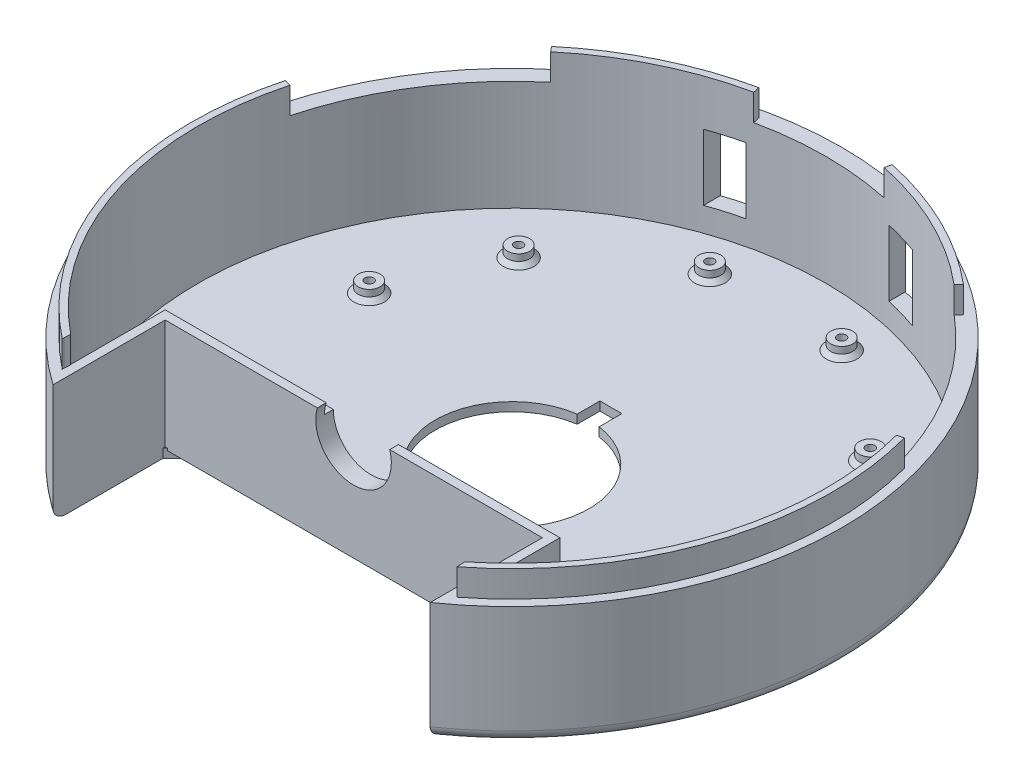
from build123d import *

# Parameters (mm, degrees)
SKETCH_1_R               = 150
EXTRUDE_1_DEPTH          = 4
SKETCH_2_R               = 150
SKETCH_2_R_2             = 145.8
EXTRUDE_2_DEPTH          = 50
SKETCH_3_R               = 145.8
SKETCH_3_R_2             = 142.8
EXTRUDE_3_DEPTH          = 62
CUT_EXTRUDE_1_DEPTH      = 223.162102979
CUT_EXTRUDE_1_DEPTH_BACK = 223.162102979
EXTRUDE_4_DEPTH          = 50
CUT_EXTRUDE_START        = -12
CUT_EXTRUDE_2_DEPTH      = 12
FILLET_1_R               = 5
CUT_EXTRUDE_3_DEPTH      = 223.162103114
CUT_EXTRUDE_3_DEPTH_BACK = 223.162103114
SKETCH_7_R               = 35
CUT_EXTRUDE_4_DEPTH      = 25
SKETCH_9_W               = 10
SKETCH_9_H               = 20
CUT_EXTRUDE_5_DEPTH      = 25
SKETCH_10_R              = 17.2
CUT_EXTRUDE_6_DEPTH      = 25
EXTRUDE_START            = 4
EXTRUDE_5_DEPTH          = 4
SKETCH_12_R              = 5
SKETCH_12_R_2            = 2
SKETCH_12_R_3            = 5.00000108
SKETCH_12_R_4            = 2.00000108
EXTRUDE_6_DEPTH          = 5
CHAMFER_1_SIZE           = 2
CHAMFER_2_SIZE           = 3
SKETCH_13_W              = 15
SKETCH_13_H              = 30
CUT_EXTRUDE_7_DEPTH      = 223.162103114


with BuildPart() as part:
    # 스케치1 → 보스-돌출1 (new body)
    with BuildSketch(Plane(origin=(0, 0, 0), x_dir=(1, 0, 0), z_dir=(0, 1, 0))):
        with Locations(Location((0, 0, 0), (0, 0, 270))):
            Circle(SKETCH_1_R)
    extrude(amount=EXTRUDE_1_DEPTH)

    # 스케치2 → 보스-돌출2 (add)
    with BuildSketch(Plane(origin=(0, 4, 0), x_dir=(1, 0, 0), z_dir=(0, 1, 0))):
        with Locations(Location((0, 0, 0), (0, 0, 270))):
            Circle(SKETCH_2_R)
        with Locations(Location((0, 0, 0), (0, 0, 270))):
            Circle(SKETCH_2_R_2, mode=Mode.SUBTRACT)
    extrude(amount=EXTRUDE_2_DEPTH)

    # 스케치3 → 보스-돌출3 (add)
    with BuildSketch(Plane(origin=(0, 4, 0), x_dir=(1, 0, 0), z_dir=(0, 1, 0))):
        with Locations(Location((0, 0, 0), (0, 0, 270))):
            Circle(SKETCH_3_R)
        with Locations(Location((0, 0, 0), (0, 0, 270))):
            Circle(SKETCH_3_R_2, mode=Mode.SUBTRACT)
    extrude(amount=EXTRUDE_3_DEPTH)

    # 스케치4 → 컷-돌출1 (cut, two sides: drawn at the far end of the back side and taken through both)
    with BuildSketch(Plane.XZ.offset(-CUT_EXTRUDE_1_DEPTH_BACK)):
        with BuildLine():
            Line((85.8, 73), (85.8, 123.038042897))
            ThreePointArc((85.8, 123.038042897), (0, 150), (-85.8, 123.038042897))
            Line((-85.8, 123.038042897), (-85.8, 73))
            Line((-85.8, 73), (-84.8, 72))
            Line((-84.8, 72), (84.8, 72))
            Line((84.8, 72), (85.8, 73))
        make_face()
    extrude(amount=CUT_EXTRUDE_1_DEPTH + CUT_EXTRUDE_1_DEPTH_BACK, mode=Mode.SUBTRACT)

    # 스케치5 → 보스-돌출4 (add)
    with BuildSketch(Plane(origin=(0, 4, 0), x_dir=(1, 0, 0), z_dir=(0, 1, 0))):
        with BuildLine():
            Line((-86.456854249, -68), (-89.8, -71.343145751))
            Line((-89.8, -71.343145751), (-89.8, -114.149901445))
            Line((-89.8, -114.149901445), (-89.8, -114.863397129))
            ThreePointArc((-89.8, -114.863397129), (-87.812965607, -116.389531622), (-85.8, -117.881296226))
            Line((-85.8, -117.881296226), (-85.8, -72))
            Line((-85.8, -72), (85.8, -72))
            Line((85.8, -72), (85.8, -117.881296226))
            ThreePointArc((85.8, -117.881296226), (87.812965607, -116.389531622), (89.8, -114.863397129))
            Line((89.8, -114.863397129), (89.8, -114.149901445))
            Line((89.8, -114.149901445), (89.8, -71.343145751))
            Line((89.8, -71.343145751), (86.45685425, -68))
            Line((86.45685425, -68), (84.8, -68))
            Line((84.8, -68), (-84.8, -68))
            Line((-84.8, -68), (-86.456854249, -68))
        make_face()
        Polygon((-89.8, -68), (-89.8, -71.343145751), (-86.456854249, -68), align=None)
        Polygon((89.8, -68), (86.45685425, -68), (89.8, -71.343145751), align=None)
    extrude(amount=EXTRUDE_4_DEPTH)

    # 스케치6 → 컷-돌출2 (cut)
    with BuildSketch(Plane(origin=(0, 66, 0), x_dir=(1, 0, 0), z_dir=(0, 1, 0)).offset(CUT_EXTRUDE_START)):
        with BuildLine():
            Line((-89.8, -114.149901445), (-89.674405594, -111.132087991))
            ThreePointArc((-89.674405594, -111.132087991), (-87.750176947, -112.657651519), (-85.8, -114.149901445))
            Line((-85.8, -114.149901445), (-85.8, -117.881296226))
            ThreePointArc((-85.8, -117.881296226), (-87.812965607, -116.389531622), (-89.8, -114.863397129))
            Line((-89.8, -114.863397129), (-89.8, -114.149901445))
        make_face()
    cut_extrude_2 = extrude(amount=CUT_EXTRUDE_2_DEPTH, mode=Mode.SUBTRACT)

    # 대칭 복사1: 컷-돌출2 across plane
    add(cut_extrude_2.mirror(Plane(origin=(0, 0, 0), x_dir=(0, 0, 1), z_dir=(1, 0, 0))), mode=Mode.SUBTRACT)

    # 필렛1
    fillet_1_edges = [part.edges().sort_by_distance(p)[0] for p in [
        (0, 0, -150),
    ]]
    fillet(fillet_1_edges, radius=FILLET_1_R)

    # 스케치7 → 컷-돌출3 (cut, two sides: drawn at the far end of the back side and taken through both)
    with BuildSketch(Plane.XZ.offset(-CUT_EXTRUDE_3_DEPTH_BACK)):
        with Locations(Location((0, 0, 0), (0, 0, 90))):
            Circle(SKETCH_7_R)
    extrude(amount=CUT_EXTRUDE_3_DEPTH + CUT_EXTRUDE_3_DEPTH_BACK, mode=Mode.SUBTRACT)

    # 스케치8 → 컷-돌출4 (cut)
    with BuildSketch(Plane(origin=(0, 54, 0), x_dir=(1, 0, 0), z_dir=(0, 1, 0))):
        with BuildLine():
            ThreePointArc((0, 150), (-15.67926949, 149.178284305), (-31.186753623, 146.72214011))
            Line((-31.186753623, 146.72214011), (-30.313524521, 142.613920187))
            ThreePointArc((-30.313524521, 142.613920187), (-15.240249944, 145.001292345), (0, 145.8))
            Line((0, 145.8), (0, 150))
        make_face()
        with BuildLine():
            ThreePointArc((0, 145.8), (-15.240249944, 145.001292345), (-30.313524521, 142.613920187))
            Line((-30.313524521, 142.613920187), (-29.523460096, 138.896959304))
            ThreePointArc((-29.523460096, 138.896959304), (-14.843041784, 141.222109142), (0, 142))
            Line((0, 142), (0, 145.8))
        make_face()
        with BuildLine():
            ThreePointArc((-90.633052966, 108.01226648), (-118.91819386, 75.759244777), (-136.195541507, 36.493485359))
            Line((-136.195541507, 36.493485359), (-140.059244812, 37.52876154))
            Line((-140.059244812, 37.52876154), (-144.888873943, 38.822856765))
            ThreePointArc((-144.888873943, 38.822856765), (-126.508716872, 80.594941252), (-96.418141453, 114.906666468))
            Line((-96.418141453, 114.906666468), (-93.204203405, 111.076444252))
            Line((-93.204203405, 111.076444252), (-90.633052966, 108.01226648))
        make_face()
    cut_extrude_4 = extrude(amount=CUT_EXTRUDE_4_DEPTH, mode=Mode.SUBTRACT)

    # 대칭 복사2: 컷-돌출4 across plane
    add(cut_extrude_4.mirror(Plane(origin=(0, 0, 0), x_dir=(0, 0, 1), z_dir=(1, 0, 0))), mode=Mode.SUBTRACT)

    # 스케치9 → 컷-돌출5 (cut)
    with BuildSketch(Plane.XZ):
        with Locations((0, -35)):
            Rectangle(SKETCH_9_W, SKETCH_9_H)
    extrude(amount=-CUT_EXTRUDE_5_DEPTH, mode=Mode.SUBTRACT)

    # 스케치10 → 컷-돌출6 (cut)
    with BuildSketch(Plane(origin=(0, 0, 68), x_dir=(-1, 0, 0), z_dir=(0, 0, -1))):
        with Locations((0.117103381, 49)):
            Circle(SKETCH_10_R)
    extrude(amount=-CUT_EXTRUDE_6_DEPTH, mode=Mode.SUBTRACT)

    # 스케치11 → 보스-돌출5 (add)
    with BuildSketch(Plane(origin=(0, 0, 68), x_dir=(-1, 0, 0), z_dir=(0, 0, -1)).offset(EXTRUDE_START)):
        with BuildLine():
            Line((17.317103381, 49), (21.317103381, 49))
            ThreePointArc((21.317103381, 49), (0.117103381, 27.8), (-21.082896619, 49))
            Line((-21.082896619, 49), (-17.082896619, 49))
            ThreePointArc((-17.082896619, 49), (0.117103381, 31.8), (17.317103381, 49))
        make_face()
    extrude(amount=-EXTRUDE_5_DEPTH)

    # 스케치12 → 보스-돌출6 (add)
    # profile 1 of 6: a face of its own
    with BuildSketch(Plane(origin=(0, 4, 0), x_dir=(1, 0, 0), z_dir=(0, 1, 0))):
        with Locations(Location((100, 35, 0), (0, 0, 270))):
            Circle(SKETCH_12_R)
        with Locations(Location((100, 35, 0), (0, 0, 270))):
            Circle(SKETCH_12_R_2, mode=Mode.SUBTRACT)
    # profile 2 of 6: a face of its own
    with BuildSketch(Plane(origin=(0, 4, 0), x_dir=(1, 0, 0), z_dir=(0, 1, 0))):
        with Locations(Location((-100, 35, 0), (0, 0, 270))):
            Circle(SKETCH_12_R)
        with Locations(Location((-100, 35, 0), (0, 0, 270))):
            Circle(SKETCH_12_R_2, mode=Mode.SUBTRACT)
    # profile 3 of 6: a face of its own
    with BuildSketch(Plane(origin=(0, 4, 0), x_dir=(1, 0, 0), z_dir=(0, 1, 0))):
        with Locations(Location((-79.999996057, 83.000003885, 0), (0, 0, 270))):
            Circle(SKETCH_12_R_3)
        with Locations(Location((-79.999996057, 83.000003885, 0), (0, 0, 270))):
            Circle(SKETCH_12_R_4, mode=Mode.SUBTRACT)
    # profile 4 of 6: a face of its own
    with BuildSketch(Plane(origin=(0, 4, 0), x_dir=(1, 0, 0), z_dir=(0, 1, 0))):
        with Locations(Location((-29.99999481, 120.000031962, 0), (0, 0, 270))):
            Circle(SKETCH_12_R_3)
        with Locations(Location((-29.99999481, 120.000031962, 0), (0, 0, 270))):
            Circle(SKETCH_12_R_4, mode=Mode.SUBTRACT)
    # profile 5 of 6: a face of its own
    with BuildSketch(Plane(origin=(0, 4, 0), x_dir=(1, 0, 0), z_dir=(0, 1, 0))):
        with Locations(Location((29.99998679, 120.000032533, 0), (0, 0, 270))):
            Circle(SKETCH_12_R_3)
        with Locations(Location((29.99998679, 120.000032533, 0), (0, 0, 270))):
            Circle(SKETCH_12_R_4, mode=Mode.SUBTRACT)
    # profile 6 of 6: a face of its own
    with BuildSketch(Plane(origin=(0, 4, 0), x_dir=(1, 0, 0), z_dir=(0, 1, 0))):
        with Locations(Location((79.999988743, 83.000005409, 0), (0, 0, 270))):
            Circle(SKETCH_12_R_3)
        with Locations(Location((79.999988743, 83.000005409, 0), (0, 0, 270))):
            Circle(SKETCH_12_R_4, mode=Mode.SUBTRACT)
    extrude(amount=EXTRUDE_6_DEPTH)

    # 모따기1
    chamfer_1_edges = [part.edges().sort_by_distance(p)[0] for p in [
        (100, 4, -40),
        (-79.999996057, 4, -88.000004965),
        (-100, 4, -40),
        (-29.99999481, 4, -125.000033042),
        (29.99998679, 4, -125.000033613),
        (79.999988743, 4, -88.000006489),
    ]]
    chamfer(chamfer_1_edges, length=CHAMFER_1_SIZE)

    # 모따기2
    chamfer_2_edges = [part.edges().sort_by_distance(p)[0] for p in [
        (0, 0, 72),
    ]]
    chamfer(chamfer_2_edges, length=CHAMFER_2_SIZE)

    # 스케치13 → 컷-돌출7 (cut, through all)
    with BuildSketch(Plane.XY):
        with Locations((-40, 30)):
            Rectangle(SKETCH_13_W, SKETCH_13_H)
        with Locations((40, 30)):
            Rectangle(SKETCH_13_W, SKETCH_13_H)
    extrude(amount=-CUT_EXTRUDE_7_DEPTH, mode=Mode.SUBTRACT)


solid = part.part
